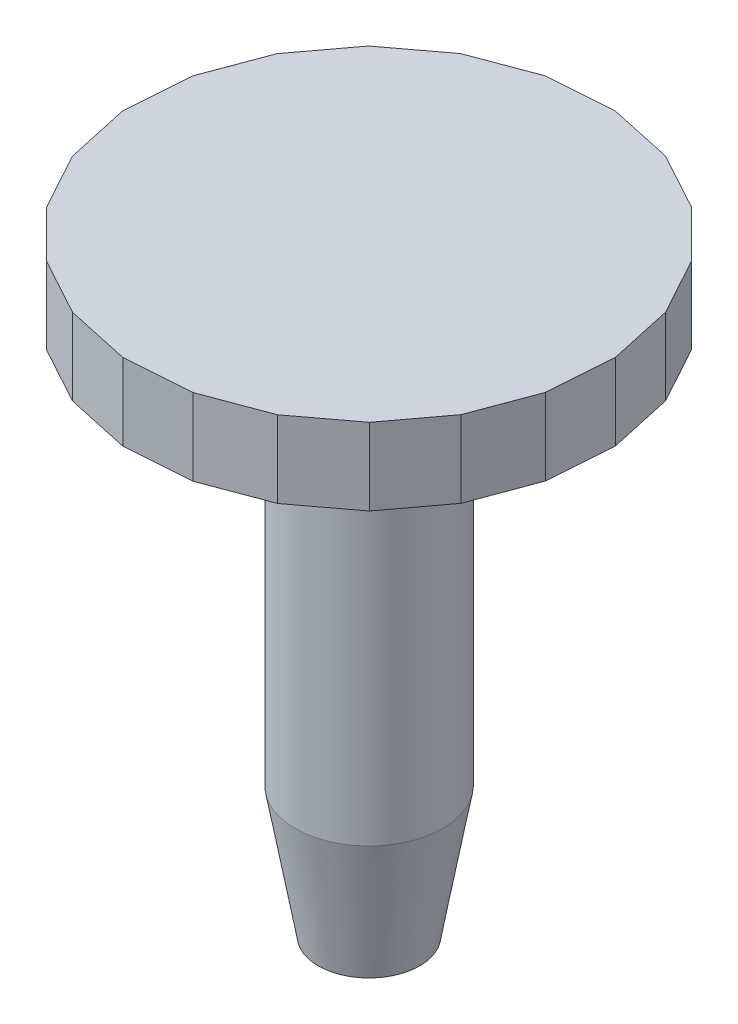
from build123d import *

# Parameters (mm, degrees)
SKETCH1_R           = 3.048
BOSS_EXTRUDE1_DEPTH = 5.3975
BOSS_EXTRUDE1_DRAFT = -10
SKETCH3_R           = 3.048
BOSS_EXTRUDE2_DEPTH = 14.986
SKETCH4_R           = 3.048
BOSS_EXTRUDE3_DEPTH = 1.5875
BOSS_EXTRUDE3_DRAFT = -75
BOSS_EXTRUDE5_DEPTH = 3.175


with BuildPart() as part:
    # Sketch1 → Boss-Extrude1 (with draft: the straight prism first)
    with BuildSketch(Plane(origin=(0, 0, 0), x_dir=(1, 0, 0), z_dir=(0, 1, 0))):
        Circle(SKETCH1_R)
    extrude(amount=-BOSS_EXTRUDE1_DEPTH)
    # Boss-Extrude1: the draft: its side faces are tilted about the plane it starts from
    boss_extrude1_sides = [part.faces().sort_by_distance(p)[0] for p in [
        (-3.048, -2.69875, 0),
    ]]
    draft(boss_extrude1_sides, Plane(origin=(0, 0, 0), x_dir=(1, 0, 0), z_dir=(0, 1, 0)), BOSS_EXTRUDE1_DRAFT)

    # Sketch3 → Boss-Extrude2 (add)
    with BuildSketch(Plane(origin=(0, 0, 0), x_dir=(1, 0, 0), z_dir=(0, 1, 0))):
        with Locations(Location((0, 0, 0), (0, 0, 270))):
            Circle(SKETCH3_R)
    extrude(amount=BOSS_EXTRUDE2_DEPTH)


with BuildPart() as boss_extrude3_tool:
    # Sketch4 → Boss-Extrude3 (with draft: the straight prism first)
    with BuildSketch(Plane(origin=(0, 14.986, 0), x_dir=(1, 0, 0), z_dir=(0, 1, 0))):
        with Locations(Location((0, 0, 0), (0, 0, 270))):
            Circle(SKETCH4_R)
    extrude(amount=BOSS_EXTRUDE3_DEPTH)
    # Boss-Extrude3: the draft: its side faces are tilted about the plane it starts from
    boss_extrude3_sides = [boss_extrude3_tool.faces().sort_by_distance(p)[0] for p in [
        (0, 15.77975, -3.048),
    ]]
    draft(boss_extrude3_sides, Plane(origin=(0, 14.986, 0), x_dir=(1, 0, 0), z_dir=(0, 1, 0)), BOSS_EXTRUDE3_DRAFT)


with BuildPart() as part_1:
    add(part.part)

    # Boss-Extrude3: add boss_extrude3_tool
    add(boss_extrude3_tool.part)

    # Sketch6 → Boss-Extrude5 (add)
    with BuildSketch(Plane(origin=(0, 16.5735, 0), x_dir=(1, 0, 0), z_dir=(0, 1, 0))):
        Polygon((3.317975387, 8.928418916), (0.66814778, 9.501536904), (-2.035809185, 9.304896881), (-4.574836998, 8.35442945), (-6.743238725, 6.727135831), (-8.365343354, 4.554849675), (-9.309737615, 2.013556687), (-9.499912302, -0.690862688), (-8.920460592, -3.339312478), (-7.618326217, -5.71723103), (-5.69900036, -7.631973526), (-3.317975387, -8.928418916), (-0.66814778, -9.501536904), (2.035809185, -9.304896881), (4.574836998, -8.35442945), (6.743238725, -6.727135831), (8.365343354, -4.554849675), (9.309737615, -2.013556687), (9.499912302, 0.690862688), (8.920460592, 3.339312478), (7.618326217, 5.71723103), (5.69900036, 7.631973526), align=None)
    extrude(amount=BOSS_EXTRUDE5_DEPTH)


solid = part_1.part
